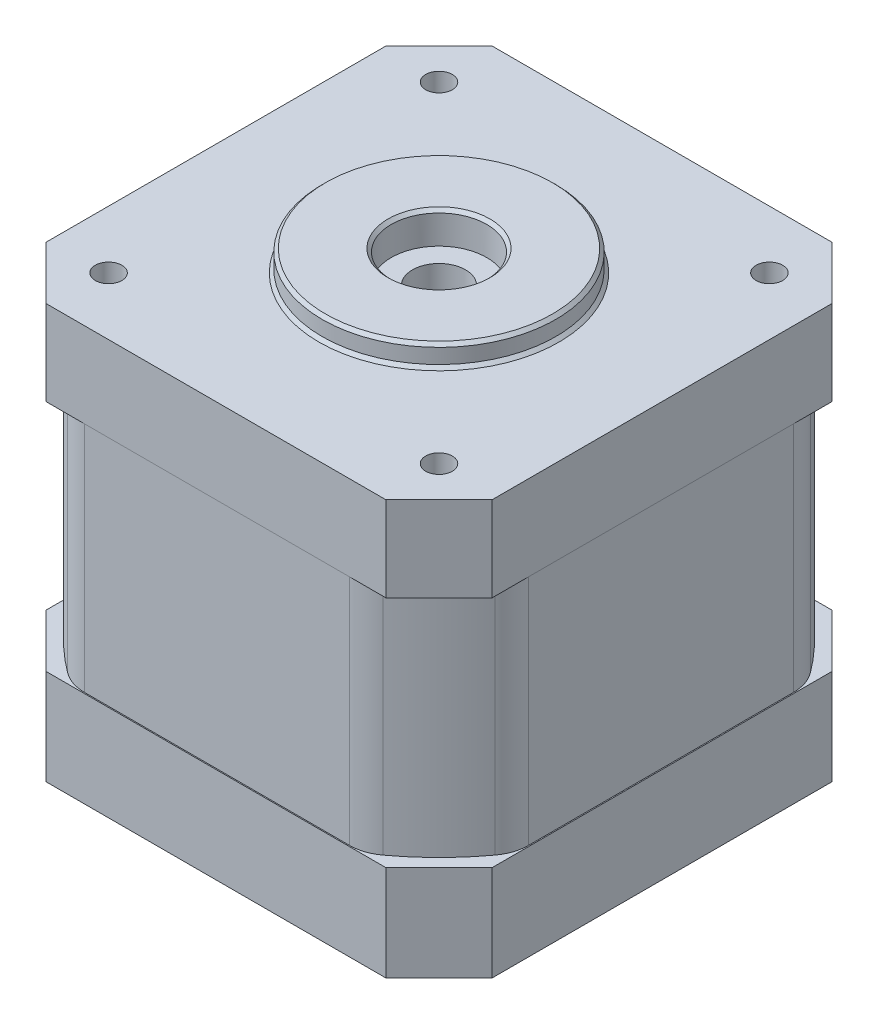
from build123d import *

# Parameters (mm, degrees)
ESQUISSE1_W             = 42
ESQUISSE1_H             = 42
BOSS_EXTRU_1_DEPTH      = 8
CHANFREIN1_SIZE         = 5
ESQUISSE2_R             = 11
BOSS_EXTRU_2_DEPTH      = 2
ESQUISSE5_R             = 4.5
ENL_V_MAT_EXTRU_1_DEPTH = 3
CHANFREIN2_SIZE         = 0.3
BOSS_EXTRU_3_DEPTH      = 22
CONG_1_R                = 4
BOSS_EXTRU_4_DEPTH      = 9
ENL_V_START             = -3
ESQUISSE8_R             = 4.5
ENL_V_MAT_EXTRU_2_DEPTH = 3
TROU_TARAUD_M31_D       = 2.5
ESQUISSE9_R             = 2.5
ENL_V_MAT_EXTRU_3_DEPTH = 49.228622207


with BuildPart() as part:
    # Esquisse1 → Boss.-Extru.1 (new body)
    with BuildSketch(Plane(origin=(0, 0, 0), x_dir=(1, 0, 0), z_dir=(0, 1, 0))):
        Rectangle(ESQUISSE1_W, ESQUISSE1_H)
    extrude(amount=-BOSS_EXTRU_1_DEPTH)

    # Chanfrein1
    chanfrein1_edges = [part.edges().sort_by_distance(p)[0] for p in [
        (-21, -4, -21),
        (21, -4, -21),
        (21, -4, 21),
        (-21, -4, 21),
    ]]
    chamfer(chanfrein1_edges, length=CHANFREIN1_SIZE)

    # Esquisse2 → Boss.-Extru.2 (add)
    with BuildSketch(Plane(origin=(0, 0, 0), x_dir=(-1, 0, 0), z_dir=(0, -1, 0))):
        with Locations(Location((0, 0, 0), (0, 0, 90))):
            Circle(ESQUISSE2_R)
    extrude(amount=-BOSS_EXTRU_2_DEPTH)

    # Esquisse5 → Enlèv. mat.-Extru.1 (cut)
    with BuildSketch(Plane(origin=(0, 2, 0), x_dir=(1, 0, 0), z_dir=(0, 1, 0))):
        with Locations(Location((0, 0, 0), (0, 0, 270))):
            Circle(ESQUISSE5_R)
    extrude(amount=-ENL_V_MAT_EXTRU_1_DEPTH, mode=Mode.SUBTRACT)

    # Chanfrein2
    chanfrein2_edges = [part.edges().sort_by_distance(p)[0] for p in [
        (0, 0, 11),
        (0, 2, 11),
        (0, 2, -4.5),
    ]]
    chamfer(chanfrein2_edges, length=CHANFREIN2_SIZE)

    # Esquisse6 → Boss.-Extru.3 (add)
    with BuildSketch(Plane.XZ.offset(8)):
        with BuildLine():
            Line((20.9, -13.718236038), (20.9, 13.718236038))
            ThreePointArc((20.9, 13.718236038), (17.67766953, 17.67766953), (13.718236038, 20.9))
            Line((13.718236038, 20.9), (-13.718236038, 20.9))
            ThreePointArc((-13.718236038, 20.9), (-17.67766953, 17.67766953), (-20.9, 13.718236038))
            Line((-20.9, 13.718236038), (-20.9, -13.718236038))
            ThreePointArc((-20.9, -13.718236038), (-17.67766953, -17.67766953), (-13.718236038, -20.9))
            Line((-13.718236038, -20.9), (13.718236038, -20.9))
            ThreePointArc((13.718236038, -20.9), (17.67766953, -17.67766953), (20.9, -13.718236038))
        make_face()
    extrude(amount=BOSS_EXTRU_3_DEPTH)

    # Congé1
    cong_1_edges = [part.edges().sort_by_distance(p)[0] for p in [
        (13.718236038, -19, -20.9),
        (20.9, -19, -13.718236038),
        (20.9, -19, 13.718236038),
        (13.718236038, -19, 20.9),
        (-13.718236038, -19, 20.9),
        (-20.9, -19, 13.718236038),
        (-20.9, -19, -13.718236038),
        (-13.718236038, -19, -20.9),
    ]]
    fillet(cong_1_edges, radius=CONG_1_R)

    # Esquisse7 → Boss.-Extru.4 (add)
    with BuildSketch(Plane.XZ.offset(30)):
        Polygon((-16, -21), (16, -21), (21, -16), (21, 16), (16, 21), (-16, 21), (-21, 16), (-21, -16), align=None)
    extrude(amount=BOSS_EXTRU_4_DEPTH)

    # Esquisse8 → Enlèv. mat.-Extru.2 (cut)
    with BuildSketch(Plane.XZ.offset(39).offset(ENL_V_START)):
        with Locations(Location((0, 0, 0), (0, 0, 90))):
            Circle(ESQUISSE8_R)
    extrude(amount=ENL_V_MAT_EXTRU_2_DEPTH, mode=Mode.SUBTRACT)

    # Trou taraudé M31 (through all)
    with Locations(Plane(origin=(-18.160222152, 0, -3.642693465), x_dir=(-1, 0, 0), z_dir=(0, 1, 0))):
        with Locations((-33.716571339, 19.199042651), (-33.716571339, -11.913655721), (-2.603872966, -11.913655721), (-2.603872966, 19.199042651)):
            Hole(TROU_TARAUD_M31_D / 2)

    # Esquisse9 → Enlèv. mat.-Extru.3 (cut, through all)
    with BuildSketch(Plane(origin=(0, -1, 0), x_dir=(1, 0, 0), z_dir=(0, 1, 0))):
        with Locations(Location((0, 0, 0), (0, 0, 270))):
            Circle(ESQUISSE9_R)
    extrude(amount=-ENL_V_MAT_EXTRU_3_DEPTH, mode=Mode.SUBTRACT)


solid = part.part
